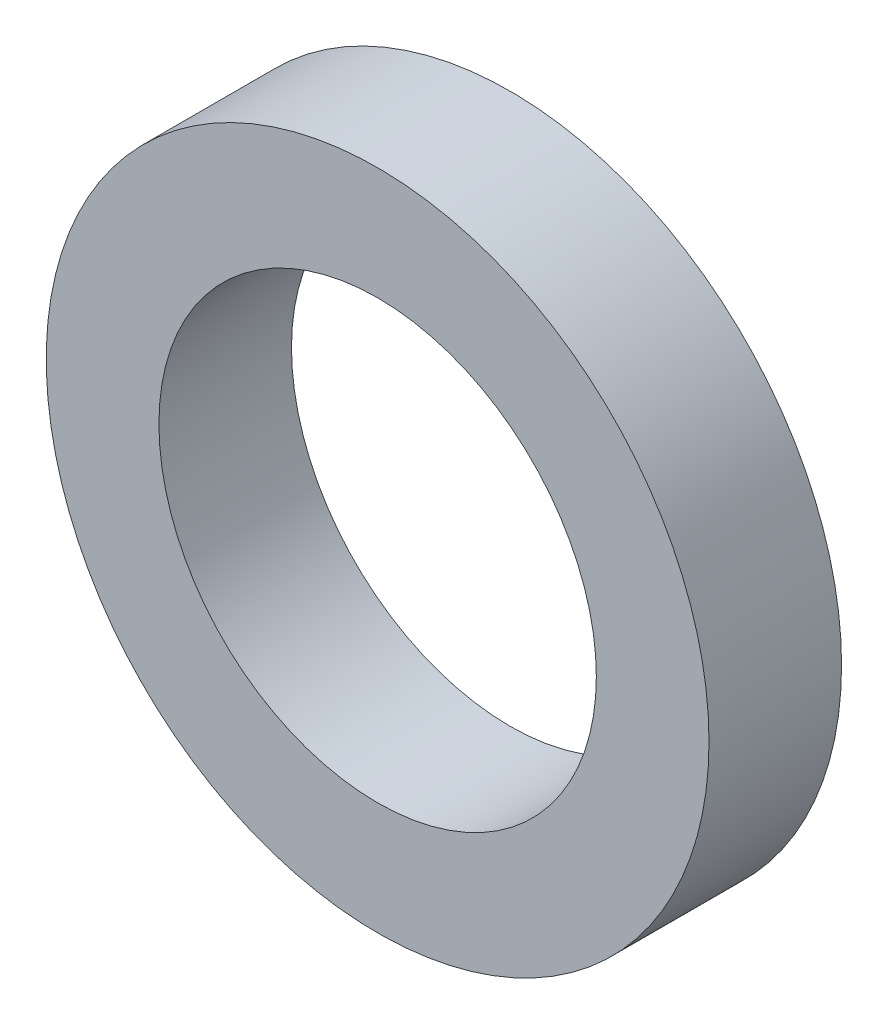
from build123d import *

# Parameters (mm, degrees)
SKETCH1_R           = 6.35
SKETCH1_R_2         = 4.191
BOSS_EXTRUDE1_DEPTH = 2.54


with BuildPart() as part:
    # Sketch1 → Boss-Extrude1 (new body)
    with BuildSketch(Plane.XY):
        Circle(SKETCH1_R)
        Circle(SKETCH1_R_2, mode=Mode.SUBTRACT)
    extrude(amount=BOSS_EXTRUDE1_DEPTH)


solid = part.part
